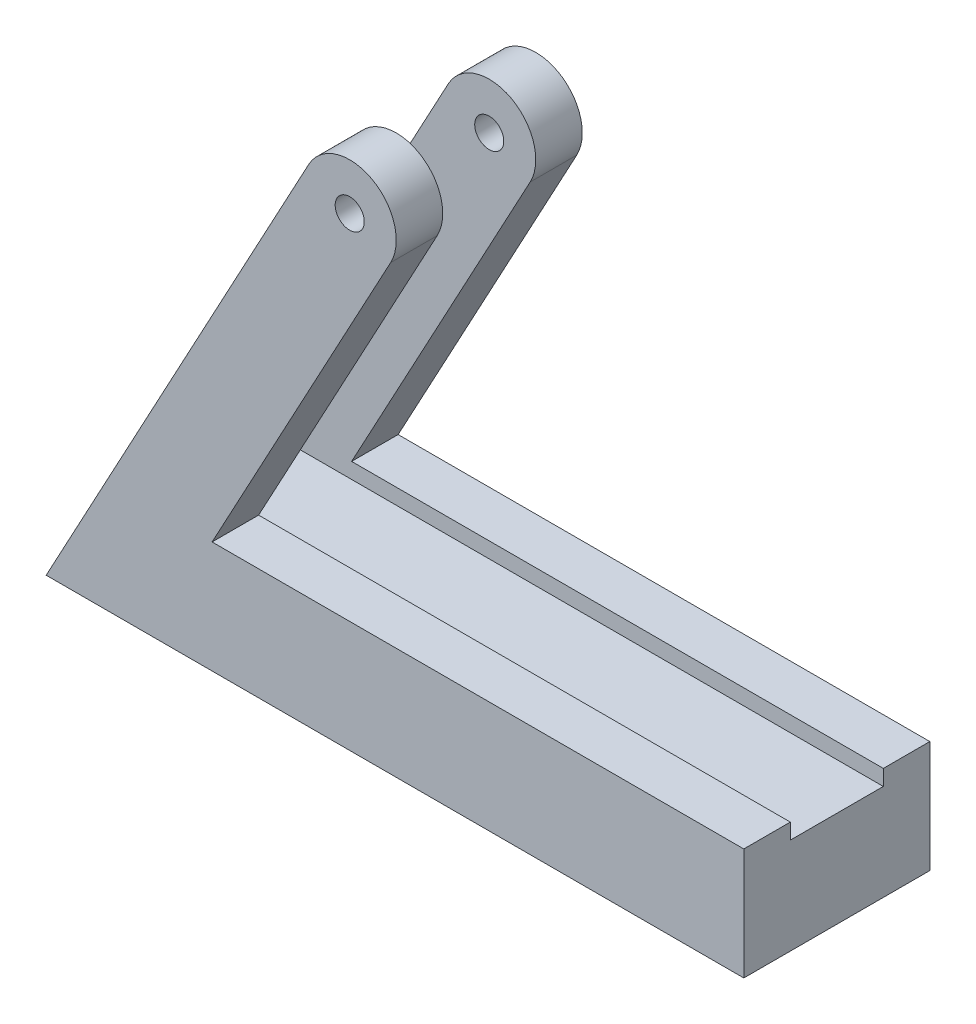
from build123d import *

# Parameters (mm, degrees)
EXTRUDE_1_DEPTH     = 8
SKETCH_2_W          = 4
SKETCH_2_H          = 18.866305448
CUT_EXTRUDE_1_DEPTH = 88
SKETCH_3_R          = 0.625
CUT_EXTRUDE_2_DEPTH = 88


with BuildPart() as part:
    # 草圖1 → 填料-伸長1 (new body)
    with BuildSketch(Plane.XY):
        with BuildLine():
            Line((0, 0), (11.292732867, 20.94901356))
            ThreePointArc((11.292732867, 20.94901356), (14.002250122, 21.760503696), (14.813740258, 19.05098644))
            Line((14.813740258, 19.05098644), (7.13506975, 4.806376698))
            Line((7.13506975, 4.806376698), (30, 4.806376698))
            Line((30, 4.806376698), (30, 0))
            Line((30, 0), (0, 0))
        make_face()
    extrude(amount=-EXTRUDE_1_DEPTH)

    # 草圖2 → 除料-伸長1 (cut)
    with BuildSketch(Plane(origin=(30, 0, 0), x_dir=(0, 0, -1), z_dir=(1, 0, 0))):
        with Locations((4, 13.566847276)):
            Rectangle(SKETCH_2_W, SKETCH_2_H)
    extrude(amount=-CUT_EXTRUDE_1_DEPTH, mode=Mode.SUBTRACT)

    # 草圖3 → 除料-伸長2 (cut)
    with BuildSketch(Plane.XY):
        with Locations(Location((13.053236562, 20, 0), (0, 0, 180))):
            Circle(SKETCH_3_R)
    extrude(amount=-CUT_EXTRUDE_2_DEPTH, mode=Mode.SUBTRACT)


solid = part.part
